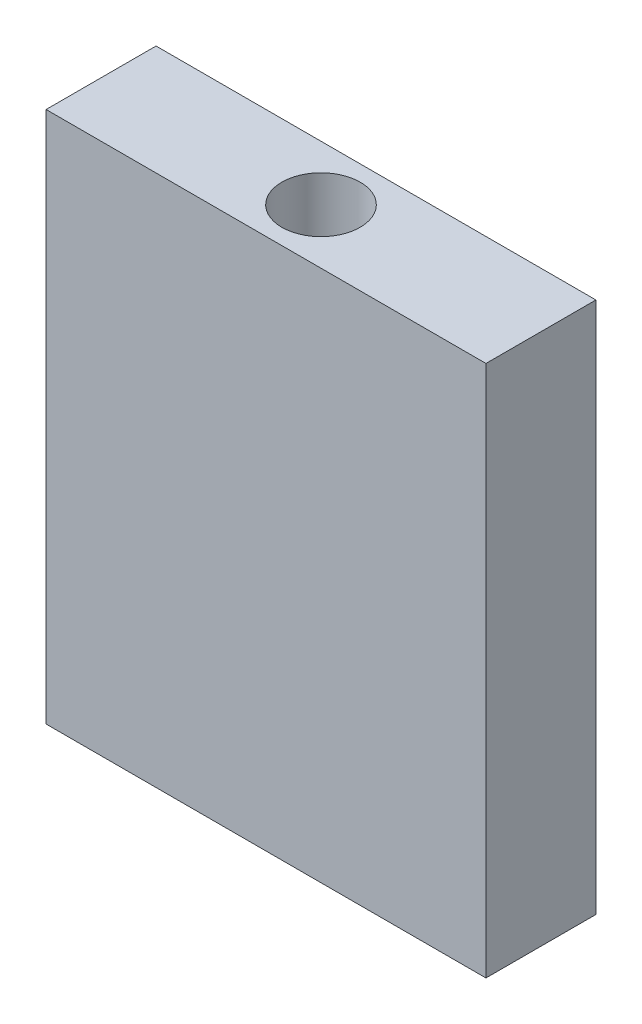
from build123d import *

# Parameters (mm, degrees)
SKETCH1_W           = 50
SKETCH1_H           = 60.5
BOSS_EXTRUDE1_DEPTH = 12.5
SKETCH2_R           = 4.45
CUT_EXTRUDE1_DEPTH  = 12.5


with BuildPart() as part:
    # Sketch1 → Boss-Extrude1 (new body)
    with BuildSketch(Plane.XY):
        with Locations((25, 30.25)):
            Rectangle(SKETCH1_W, SKETCH1_H)
    extrude(amount=BOSS_EXTRUDE1_DEPTH)

    # Sketch2 → Cut-Extrude1 (cut)
    with BuildSketch(Plane(origin=(0, 60.5, 0), x_dir=(1, 0, 0), z_dir=(0, 1, 0))):
        with Locations(Location((25, -6.25, 0), (0, 0, 270))):
            Circle(SKETCH2_R)
    extrude(amount=-CUT_EXTRUDE1_DEPTH, mode=Mode.SUBTRACT)


solid = part.part
